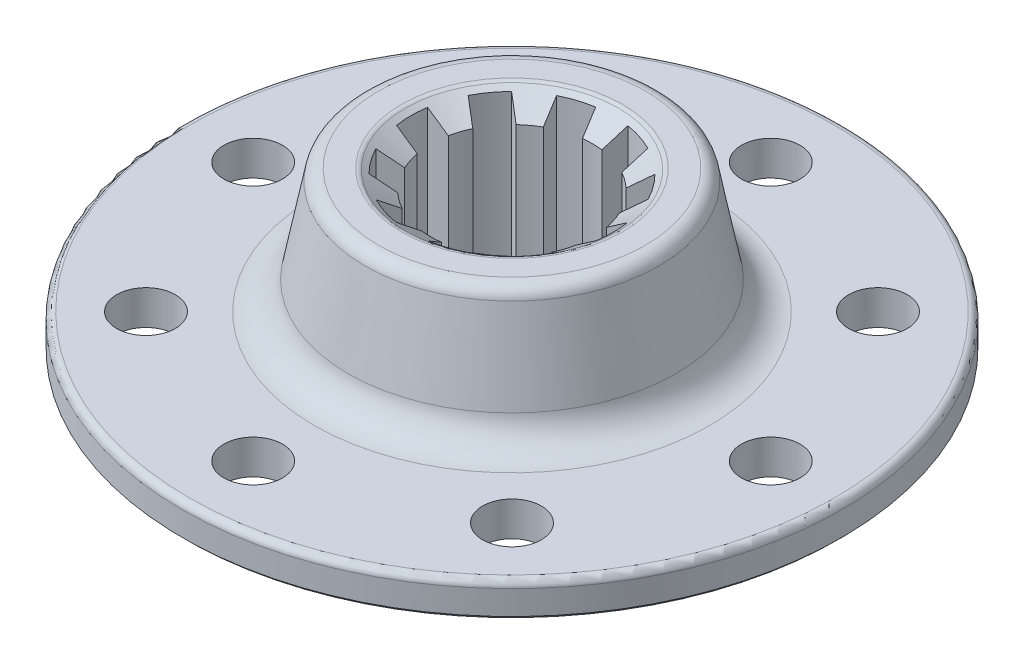
from build123d import *

# Parameters (mm, degrees)
FILETE1_R             = 5
CHANFRO1_SIZE         = 4
CHANFRO1_SIZE2        = 2.800830153
CHANFRO2_SIZE         = 3.5
CHANFRO2_SIZE2        = 2.450726384
FILETE2_R             = 2
CORTE_EXTRUS_O1_DEPTH = 73.913476121
FILETE3_R             = 1
FILETE4_R             = 1
FILETE5_R             = 0.5
FILETE6_R             = 6
FILETE7_R             = 5
CHANFRO3_SIZE         = 0.5
ESBO_O3_R             = 4.25
CORTE_EXTRUS_O2_DEPTH = 10


with BuildPart() as part:
    # Esboço1 → Revolução1 (revolve)
    with BuildSketch(Plane.XY, mode=Mode.PRIVATE) as revolu_o1_sk:
        Polygon((11.7, 16.682924335), (11.7, -10.817075665), (19.25, -10.817075665), (22.25, -7.817075665), (25.9, -7.817075665), (25.9, -5.817075665), (27, -5.817075665), (27.5, -6.317075665), (47.75, -6.317075665), (47.75, -1.317075665), (24.498845564, -1.317075665), (21, 16.682924335), align=None)
    revolve(revolu_o1_sk.sketch.rotate(Axis((0, -45.696625767, 0), (0, 1, 0)), 90), axis=Axis((0, -45.696625767, 0), (0, 1, 0)))

    # Filete1
    filete1_edges = [part.edges().sort_by_distance(p)[0] for p in [
        (0, -1.317075665, 24.498845564),
    ]]
    fillet(filete1_edges, radius=FILETE1_R)

    # Chanfro1
    chanfro1_edges = [part.edges().sort_by_distance(p)[0] for p in [
        (0, 16.682924335, 11.7),
    ]]
    chanfro1_side = [part.faces().sort_by_distance(p)[0] for p in [
        (0, 16.682924335, 20.406030304),
    ]]
    chamfer(chanfro1_edges, length=CHANFRO1_SIZE, length2=CHANFRO1_SIZE2, reference=chanfro1_side[0])

    # Chanfro2
    chanfro2_edges = [part.edges().sort_by_distance(p)[0] for p in [
        (0, -10.817075665, 11.7),
    ]]
    chanfro2_side = [part.faces().sort_by_distance(p)[0] for p in [
        (0, -10.817075665, 12.244472222),
    ]]
    chamfer(chanfro2_edges, length=CHANFRO2_SIZE, length2=CHANFRO2_SIZE2, reference=chanfro2_side[0])

    # Filete2
    filete2_edges = [part.edges().sort_by_distance(p)[0] for p in [
        (0, 16.682924335, 21),
    ]]
    fillet(filete2_edges, radius=FILETE2_R)

    # Esboço2 → Corte-extrusão1 (cut, through all)
    with BuildSketch(Plane(origin=(0, 16.682924335, 0), x_dir=(1, 0, 0), z_dir=(0, 1, 0))):
        with BuildLine():
            Line((-9.684760325, 2.25), (-9.684760325, -2.25))
            Line((-9.684760325, -2.25), (-14.476187343, -2.25))
            ThreePointArc((-14.476187343, -2.25), (-14.65, 0), (-14.476187343, 2.25))
            Line((-14.476187343, 2.25), (-9.684760325, 2.25))
        make_face()
        with BuildLine():
            Line((-6.512618871, 7.512847528), (-9.157652507, 3.872271053))
            Line((-9.157652507, 3.872271053), (-13.033998392, 6.688601193))
            ThreePointArc((-13.033998392, 6.688601193), (-11.852098968, 8.611053946), (-10.388964757, 10.329177667))
            Line((-10.388964757, 10.329177667), (-6.512618871, 7.512847528))
        make_face()
        with BuildLine():
            Line((-0.852878365, 9.906042653), (-5.132632688, 8.515466178))
            Line((-5.132632688, 8.515466178), (-6.613265065, 13.072384067))
            ThreePointArc((-6.613265065, 13.072384067), (-4.527098968, 13.932977964), (-2.333510741, 14.462960541))
            Line((-2.333510741, 14.462960541), (-0.852878365, 9.906042653))
        make_face()
        with BuildLine():
            Line((5.132632688, 8.515466178), (0.852878365, 9.906042653))
            Line((0.852878365, 9.906042653), (2.333510741, 14.462960541))
            ThreePointArc((2.333510741, 14.462960541), (4.527098968, 13.932977964), (6.613265065, 13.072384067))
            Line((6.613265065, 13.072384067), (5.132632688, 8.515466178))
        make_face()
        with BuildLine():
            Line((9.157652507, 3.872271053), (6.512618871, 7.512847528))
            Line((6.512618871, 7.512847528), (10.388964757, 10.329177667))
            ThreePointArc((10.388964757, 10.329177667), (11.852098968, 8.611053946), (13.033998392, 6.688601193))
            Line((13.033998392, 6.688601193), (9.157652507, 3.872271053))
        make_face()
        with BuildLine():
            Line((9.684760325, -2.25), (9.684760325, 2.25))
            Line((9.684760325, 2.25), (14.476187343, 2.25))
            ThreePointArc((14.476187343, 2.25), (14.65, 0), (14.476187343, -2.25))
            Line((14.476187343, -2.25), (9.684760325, -2.25))
        make_face()
        with BuildLine():
            Line((6.512618871, -7.512847528), (9.157652507, -3.872271053))
            Line((9.157652507, -3.872271053), (13.033998392, -6.688601193))
            ThreePointArc((13.033998392, -6.688601193), (11.852098968, -8.611053946), (10.388964757, -10.329177667))
            Line((10.388964757, -10.329177667), (6.512618871, -7.512847528))
        make_face()
        with BuildLine():
            Line((0.852878365, -9.906042653), (5.132632688, -8.515466178))
            Line((5.132632688, -8.515466178), (6.613265065, -13.072384067))
            ThreePointArc((6.613265065, -13.072384067), (4.527098968, -13.932977964), (2.333510741, -14.462960541))
            Line((2.333510741, -14.462960541), (0.852878365, -9.906042653))
        make_face()
        with BuildLine():
            Line((-5.132632688, -8.515466178), (-0.852878365, -9.906042653))
            Line((-0.852878365, -9.906042653), (-2.333510741, -14.462960541))
            ThreePointArc((-2.333510741, -14.462960541), (-4.527098968, -13.932977964), (-6.613265065, -13.072384067))
            Line((-6.613265065, -13.072384067), (-5.132632688, -8.515466178))
        make_face()
        with BuildLine():
            Line((-9.157652507, -3.872271053), (-6.512618871, -7.512847528))
            Line((-6.512618871, -7.512847528), (-10.388964757, -10.329177667))
            ThreePointArc((-10.388964757, -10.329177667), (-11.852098968, -8.611053946), (-13.033998392, -6.688601193))
            Line((-13.033998392, -6.688601193), (-9.157652507, -3.872271053))
        make_face()
    extrude(amount=-CORTE_EXTRUS_O1_DEPTH, mode=Mode.SUBTRACT)

    # Filete3
    filete3_edges = [part.edges().sort_by_distance(p)[0] for p in [
        (0, 16.682924335, 15.7),
    ]]
    fillet(filete3_edges, radius=FILETE3_R)

    # Filete4
    filete4_edges = [part.edges().sort_by_distance(p)[0] for p in [
        (0, -1.317075665, 47.75),
    ]]
    fillet(filete4_edges, radius=FILETE4_R)

    # Filete5
    filete5_edges = [part.edges().sort_by_distance(p)[0] for p in [
        (0, -5.817075665, 27),
        (0, -5.817075665, 25.9),
    ]]
    fillet(filete5_edges, radius=FILETE5_R)

    # Filete6
    filete6_edges = [part.edges().sort_by_distance(p)[0] for p in [
        (0, -7.817075665, 22.25),
    ]]
    fillet(filete6_edges, radius=FILETE6_R)

    # Filete7
    filete7_edges = [part.edges().sort_by_distance(p)[0] for p in [
        (0, -10.817075665, 19.25),
    ]]
    fillet(filete7_edges, radius=FILETE7_R)

    # Chanfro3
    chanfro3_edges = [part.edges().sort_by_distance(p)[0] for p in [
        (0, -6.317075665, 47.75),
    ]]
    chamfer(chanfro3_edges, length=CHANFRO3_SIZE)

    # Esboço3 → Corte-extrusão2 (cut)
    with BuildSketch(Plane.XZ.offset(6.317075665)):
        with Locations(Location((-37.5, 0, 0), (0, 0, 270))):
            Circle(ESBO_O3_R)
        with Locations(Location((-26.516504294, 26.516504294, 0), (0, 0, 270))):
            Circle(ESBO_O3_R)
        with Locations(Location((0, 37.5, 0), (0, 0, 270))):
            Circle(ESBO_O3_R)
        with Locations(Location((26.516504294, 26.516504294, 0), (0, 0, 270))):
            Circle(ESBO_O3_R)
        with Locations(Location((37.5, 0, 0), (0, 0, 270))):
            Circle(ESBO_O3_R)
        with Locations(Location((26.516504294, -26.516504294, 0), (0, 0, 270))):
            Circle(ESBO_O3_R)
        with Locations(Location((0, -37.5, 0), (0, 0, 270))):
            Circle(ESBO_O3_R)
        with Locations(Location((-26.516504294, -26.516504294, 0), (0, 0, 270))):
            Circle(ESBO_O3_R)
    extrude(amount=-CORTE_EXTRUS_O2_DEPTH, mode=Mode.SUBTRACT)


solid = part.part
